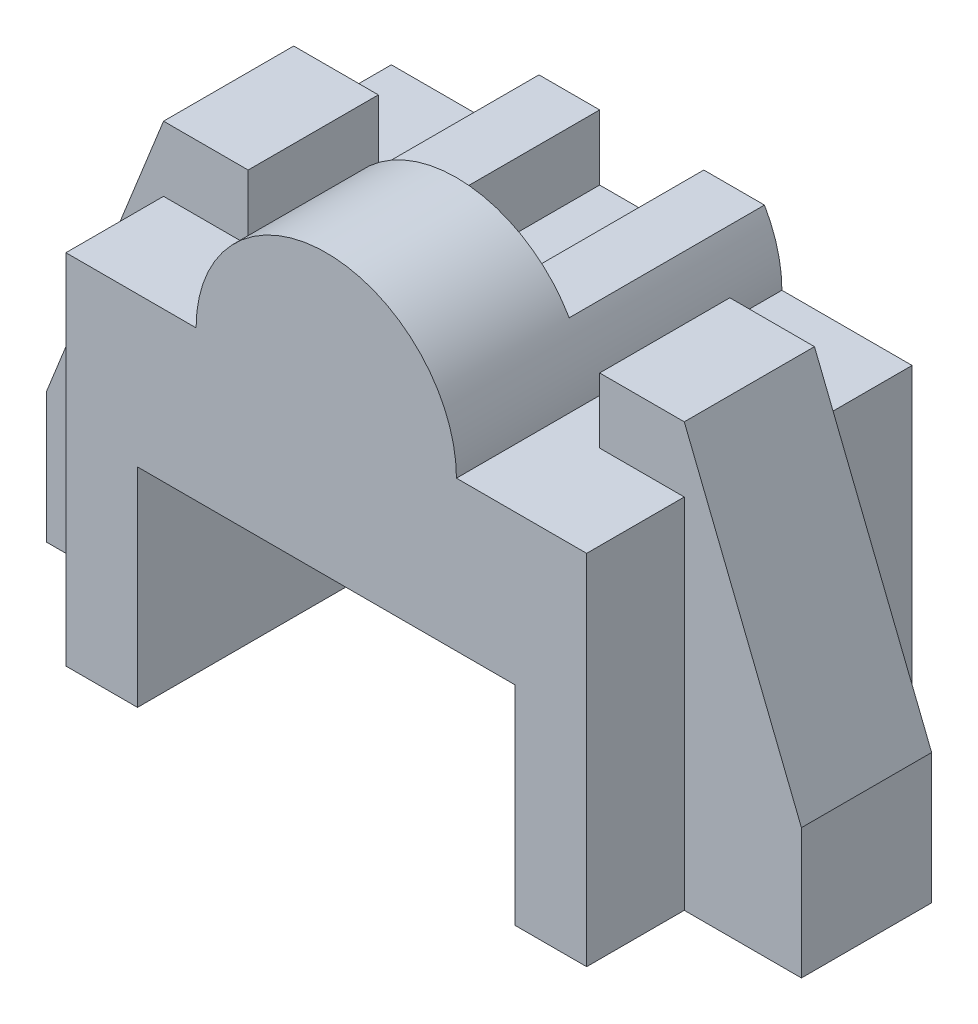
from build123d import *

# Parameters (mm, degrees)
BOSS_EXTRUDE1_DEPTH = 25
BOSS_EXTRUDE2_DEPTH = 20
BOSS_EXTRUDE3_DEPTH = 10


with BuildPart() as part:
    # Sketch1 → Boss-Extrude1 (new, symmetric)
    with BuildSketch(Plane.XY):
        with BuildLine():
            Line((-40, -27.5), (-40, 27.5))
            Line((-40, 27.5), (-20, 27.5))
            ThreePointArc((-20, 27.5), (-19.318516526, 32.676380902), (-17.320508076, 37.5))
            Line((-17.320508076, 37.5), (-8, 37.5))
            Line((-8, 37.5), (-8, 27.5))
            Line((-8, 27.5), (8, 27.5))
            Line((8, 27.5), (8, 37.5))
            Line((8, 37.5), (17.320508076, 37.5))
            ThreePointArc((17.320508076, 37.5), (19.318516526, 32.676380902), (20, 27.5))
            Line((20, 27.5), (40, 27.5))
            Line((40, 27.5), (40, -27.5))
            Line((40, -27.5), (29, -27.5))
            Line((29, -27.5), (29, 4.5))
            Line((29, 4.5), (-29, 4.5))
            Line((-29, 4.5), (-29, -27.5))
            Line((-29, -27.5), (-40, -27.5))
        make_face()
    extrude(amount=BOSS_EXTRUDE1_DEPTH, both=True)

    # Sketch2 → Boss-Extrude2 (add)
    with BuildSketch(Plane.XY.offset(25)):
        with BuildLine():
            Line((17.320508076, 37.5), (8, 37.5))
            Line((8, 37.5), (8, 27.5))
            Line((8, 27.5), (-8, 27.5))
            Line((-8, 27.5), (-8, 37.5))
            Line((-8, 37.5), (-17.320508076, 37.5))
            ThreePointArc((-17.320508076, 37.5), (0, 47.5), (17.320508076, 37.5))
        make_face()
    extrude(amount=-BOSS_EXTRUDE2_DEPTH)

    # Sketch3 → Boss-Extrude3 (add, symmetric)
    with BuildSketch(Plane.XY):
        Polygon((-40, 27.5), (-40, -27.5), (-58, -27.5), (-58, -7.5), (-40, 37.5), (-27, 37.5), (-27, 27.5), align=None)
        Polygon((27, 27.5), (40, 27.5), (40, -27.5), (58, -27.5), (58, -7.5), (40, 37.5), (27, 37.5), align=None)
    extrude(amount=BOSS_EXTRUDE3_DEPTH, both=True)


solid = part.part
